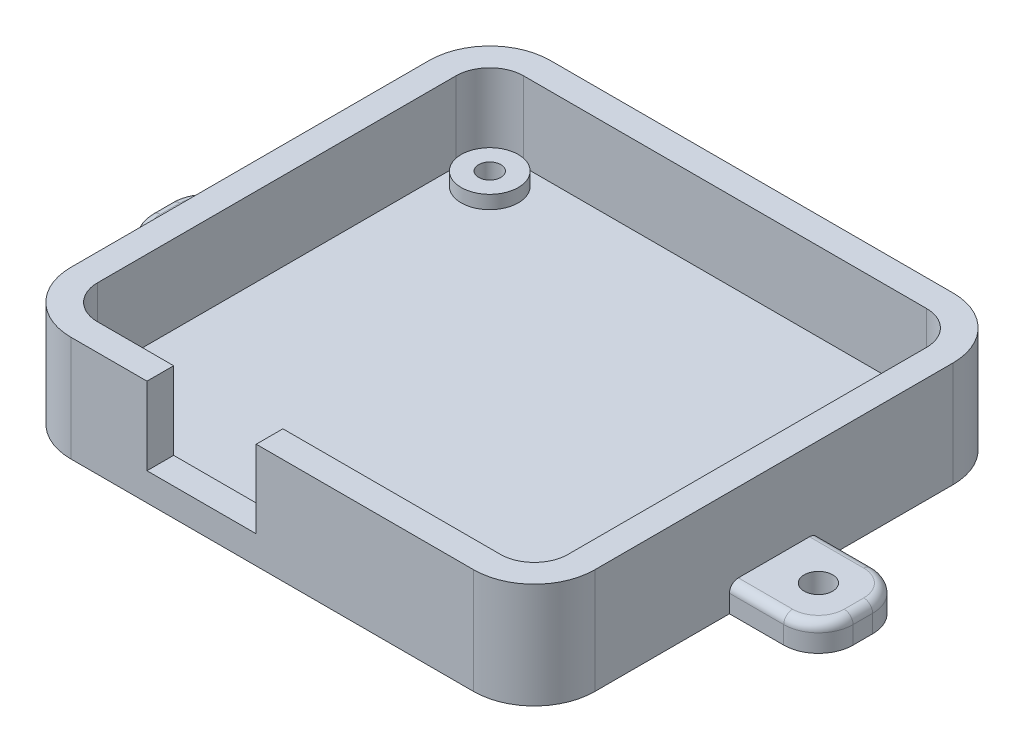
from build123d import *

# Parameters (mm, degrees)
BOSS_EXTRUDE1_DEPTH = 3
CUT_EXTRUDE1_REACH  = 77.661
SKETCH1_3_R         = 1.25
BOSS_EXTRUDE2_START = 8.86
BOSS_EXTRUDE2_DEPTH = 8.86
BOSS_EXTRUDE3_START = 1.5
SKETCH1_5_R         = 3.21
SKETCH1_5_R_2       = 1.25
BOSS_EXTRUDE3_DEPTH = 1.5
SKETCH2_W           = 12.28
SKETCH2_H           = 8.73
CUT_EXTRUDE2_DEPTH  = 3
SKETCH3_R           = 1.6
BOSS_EXTRUDE4_DEPTH = 3
FILLET1_R           = 1
FILLET2_R           = 1


with BuildPart() as part:
    # Sketch1 → Boss-Extrude1 (new body)
    with BuildSketch(Plane(origin=(0, 0, 0), x_dir=(1, 0, 0), z_dir=(0, 1, 0))):
        with BuildLine():
            Line((3.81, 3), (49.09, 3))
            ThreePointArc((49.09, 3), (53.90539718, 1.00539718), (55.9, -3.81))
            Line((55.9, -3.81), (55.9, -44.09))
            ThreePointArc((55.9, -44.09), (53.90539718, -48.90539718), (49.09, -50.9))
            Line((49.09, -50.9), (3.81, -50.9))
            ThreePointArc((3.81, -50.9), (-1.00539718, -48.90539718), (-3, -44.09))
            Line((-3, -44.09), (-3, -3.81))
            ThreePointArc((-3, -3.81), (-1.00539718, 1.00539718), (3.81, 3))
        make_face()
    extrude(amount=-BOSS_EXTRUDE1_DEPTH)

    # Sketch1<3> → Cut-Extrude1 (cut, up to next)
    with BuildSketch(Plane(origin=(0, 0, 0), x_dir=(1, 0, 0), z_dir=(0, 1, 0)), mode=Mode.PRIVATE) as cut_extrude1_sk1:
        with Locations((49.09, -44.09)):
            Circle(SKETCH1_3_R)
    cut_extrude1_tool1 = extrude(cut_extrude1_sk1.sketch, amount=-CUT_EXTRUDE1_REACH, mode=Mode.PRIVATE) & part.part
    # Sketch1<3> → Cut-Extrude1 (cut, up to next)
    with BuildSketch(Plane(origin=(0, 0, 0), x_dir=(1, 0, 0), z_dir=(0, 1, 0)), mode=Mode.PRIVATE) as cut_extrude1_sk2:
        with Locations((3.81, -44.09)):
            Circle(SKETCH1_3_R)
    cut_extrude1_tool2 = extrude(cut_extrude1_sk2.sketch, amount=-CUT_EXTRUDE1_REACH, mode=Mode.PRIVATE) & part.part
    # Sketch1<3> → Cut-Extrude1 (cut, up to next)
    with BuildSketch(Plane(origin=(0, 0, 0), x_dir=(1, 0, 0), z_dir=(0, 1, 0)), mode=Mode.PRIVATE) as cut_extrude1_sk3:
        with Locations((3.81, -3.81)):
            Circle(SKETCH1_3_R)
    cut_extrude1_tool3 = extrude(cut_extrude1_sk3.sketch, amount=-CUT_EXTRUDE1_REACH, mode=Mode.PRIVATE) & part.part
    # Sketch1<3> → Cut-Extrude1 (cut, up to next)
    with BuildSketch(Plane(origin=(0, 0, 0), x_dir=(1, 0, 0), z_dir=(0, 1, 0)), mode=Mode.PRIVATE) as cut_extrude1_sk4:
        with Locations((49.09, -3.81)):
            Circle(SKETCH1_3_R)
    cut_extrude1_tool4 = extrude(cut_extrude1_sk4.sketch, amount=-CUT_EXTRUDE1_REACH, mode=Mode.PRIVATE) & part.part
    add(cut_extrude1_tool1.solids().sort_by_distance((49.09, 0, 44.09))[0], mode=Mode.SUBTRACT)
    add(cut_extrude1_tool2.solids().sort_by_distance((3.81, 0, 44.09))[0], mode=Mode.SUBTRACT)
    add(cut_extrude1_tool3.solids().sort_by_distance((3.81, 0, 3.81))[0], mode=Mode.SUBTRACT)
    add(cut_extrude1_tool4.solids().sort_by_distance((49.09, 0, 3.81))[0], mode=Mode.SUBTRACT)

    # Sketch1<4> → Boss-Extrude2 (add)
    with BuildSketch(Plane(origin=(0, 0, 0), x_dir=(1, 0, 0), z_dir=(0, 1, 0)).offset(BOSS_EXTRUDE2_START)):
        with BuildLine():
            Line((49.09, 3), (3.81, 3))
            ThreePointArc((3.81, 3), (-1.00539718, 1.00539718), (-3, -3.81))
            Line((-3, -3.81), (-3, -44.09))
            ThreePointArc((-3, -44.09), (-1.00539718, -48.90539718), (3.81, -50.9))
            Line((3.81, -50.9), (49.09, -50.9))
            ThreePointArc((49.09, -50.9), (53.90539718, -48.90539718), (55.9, -44.09))
            Line((55.9, -44.09), (55.9, -3.81))
            ThreePointArc((55.9, -3.81), (53.90539718, 1.00539718), (49.09, 3))
        make_face()
        with BuildLine():
            ThreePointArc((0, -3.81), (1.115923164, -1.115923164), (3.81, 0))
            Line((3.81, 0), (49.09, 0))
            ThreePointArc((49.09, 0), (51.784076836, -1.115923164), (52.9, -3.81))
            Line((52.9, -3.81), (52.9, -44.09))
            ThreePointArc((52.9, -44.09), (51.784076836, -46.784076836), (49.09, -47.9))
            Line((49.09, -47.9), (3.81, -47.9))
            ThreePointArc((3.81, -47.9), (1.115923164, -46.784076836), (0, -44.09))
            Line((0, -44.09), (0, -3.81))
        make_face(mode=Mode.SUBTRACT)
    extrude(amount=-BOSS_EXTRUDE2_DEPTH)

    # Sketch1<5> → Boss-Extrude3 (add)
    # profile 1 of 4: a face of its own
    with BuildSketch(Plane(origin=(0, 0, 0), x_dir=(1, 0, 0), z_dir=(0, 1, 0)).offset(BOSS_EXTRUDE3_START)):
        with Locations((3.81, -3.81)):
            Circle(SKETCH1_5_R)
        with Locations((3.81, -3.81)):
            Circle(SKETCH1_5_R_2, mode=Mode.SUBTRACT)
    # profile 2 of 4: a face of its own
    with BuildSketch(Plane(origin=(0, 0, 0), x_dir=(1, 0, 0), z_dir=(0, 1, 0)).offset(BOSS_EXTRUDE3_START)):
        with Locations((49.09, -3.81)):
            Circle(SKETCH1_5_R)
        with Locations((49.09, -3.81)):
            Circle(SKETCH1_5_R_2, mode=Mode.SUBTRACT)
    # profile 3 of 4: a face of its own
    with BuildSketch(Plane(origin=(0, 0, 0), x_dir=(1, 0, 0), z_dir=(0, 1, 0)).offset(BOSS_EXTRUDE3_START)):
        with Locations((49.09, -44.09)):
            Circle(SKETCH1_5_R)
        with Locations((49.09, -44.09)):
            Circle(SKETCH1_5_R_2, mode=Mode.SUBTRACT)
    # profile 4 of 4: a face of its own
    with BuildSketch(Plane(origin=(0, 0, 0), x_dir=(1, 0, 0), z_dir=(0, 1, 0)).offset(BOSS_EXTRUDE3_START)):
        with Locations((3.81, -44.09)):
            Circle(SKETCH1_5_R)
        with Locations((3.81, -44.09)):
            Circle(SKETCH1_5_R_2, mode=Mode.SUBTRACT)
    extrude(amount=-BOSS_EXTRUDE3_DEPTH)

    # Sketch2 → Cut-Extrude2 (cut)
    with BuildSketch(Plane.XY.offset(50.9)):
        with Locations((18.5, 4.5)):
            Rectangle(SKETCH2_W, SKETCH2_H)
    extrude(amount=-CUT_EXTRUDE2_DEPTH, mode=Mode.SUBTRACT)

    # Sketch3 → Boss-Extrude4 (add)
    # profile 1 of 2: a face of its own
    with BuildSketch(Plane.XZ.offset(3)):
        with BuildLine():
            Line((55.9, 18.95), (62, 18.95))
            ThreePointArc((62, 18.95), (64.757716447, 20.092283553), (65.9, 22.85))
            Line((65.9, 22.85), (65.9, 25.05))
            ThreePointArc((65.9, 25.05), (64.757716447, 27.807716447), (62, 28.95))
            Line((62, 28.95), (55.9, 28.95))
            Line((55.9, 28.95), (55.9, 18.95))
        make_face()
        with Locations((60.9, 23.95)):
            Circle(SKETCH3_R, mode=Mode.SUBTRACT)
    # profile 2 of 2: a face of its own
    with BuildSketch(Plane.XZ.offset(3)):
        with BuildLine():
            Line((-3, 18.95), (-9.1, 18.95))
            ThreePointArc((-9.1, 18.95), (-11.857716447, 20.092283553), (-13, 22.85))
            Line((-13, 22.85), (-13, 25.05))
            ThreePointArc((-13, 25.05), (-11.857716447, 27.807716447), (-9.1, 28.95))
            Line((-9.1, 28.95), (-3, 28.95))
            Line((-3, 28.95), (-3, 18.95))
        make_face()
        with Locations((-8, 23.95)):
            Circle(SKETCH3_R, mode=Mode.SUBTRACT)
    extrude(amount=-BOSS_EXTRUDE4_DEPTH)

    # Fillet1
    fillet1_edges = [part.edges().sort_by_distance(p)[0] for p in [
        (58.95, 0, 18.95),
        (64.757716447, 0, 20.092283553),
        (65.9, 0, 23.95),
        (64.757716447, 0, 27.807716447),
        (58.95, 0, 28.95),
    ]]
    fillet(fillet1_edges, radius=FILLET1_R)

    # Fillet2
    fillet2_edges = [part.edges().sort_by_distance(p)[0] for p in [
        (-6.05, 0, 18.95),
        (-11.857716447, 0, 20.092283553),
        (-13, 0, 23.95),
        (-11.857716447, 0, 27.807716447),
        (-6.05, 0, 28.95),
    ]]
    fillet(fillet2_edges, radius=FILLET2_R)


solid = part.part
